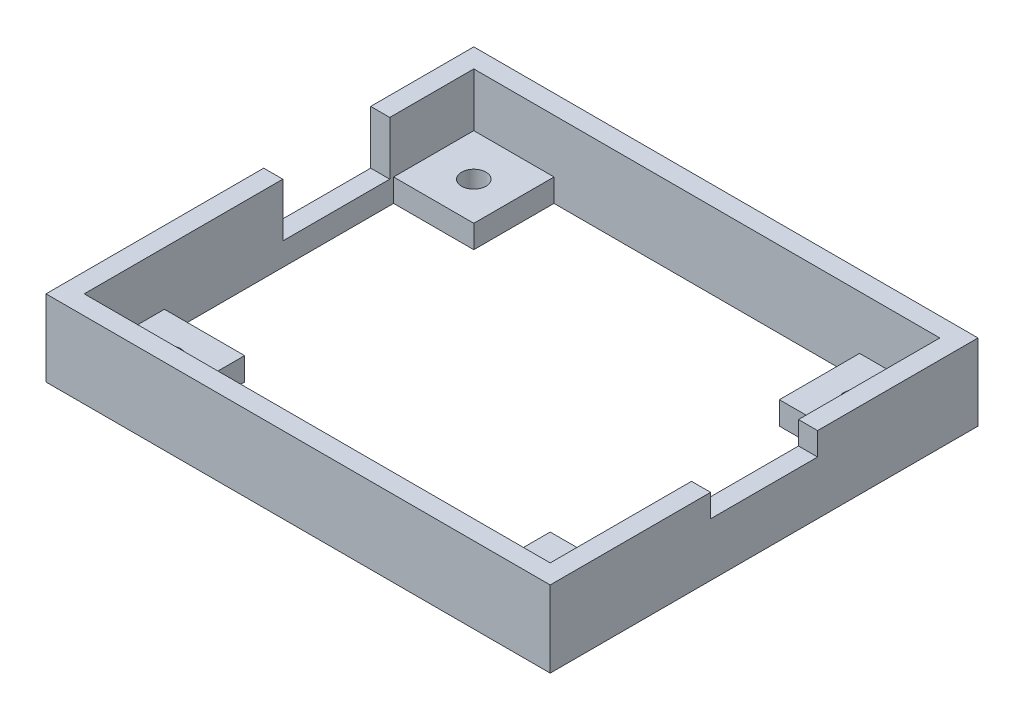
from build123d import *

# Parameters (mm, degrees)
SKETCH_1_W                  = 66
SKETCH_1_H                  = 56
EXTRUDE_1_DEPTH             = 10
SKETCH_2_W                  = 61
SKETCH_2_H                  = 51
CUT_EXTRUDE_1_DEPTH         = 7
SKETCH_3_R                  = 1.6
CUT_EXTRUDE_2_DEPTH         = 44.840620434
PATTERN_LINEAR_1_COUNT      = 2
PATTERN_LINEAR_1_PITCH      = 50
PATTERN_LINEAR_1_COUNT_DIR2 = 2
PATTERN_LINEAR_1_PITCH_DIR2 = 40
SKETCH_4_W                  = 40
SKETCH_4_H                  = 10.5
SKETCH_4_W_2                = 10.5
SKETCH_4_H_2                = 30
CUT_EXTRUDE_3_DEPTH         = 44.840620434
SKETCH_6_W                  = 14
SKETCH_6_H                  = 7
CUT_EXTRUDE_6_DEPTH         = 10
SKETCH_7_W                  = 14
SKETCH_7_H                  = 3
CUT_EXTRUDE_7_DEPTH         = 10


with BuildPart() as part:
    # 草图1 → 凸台-拉伸1 (new body)
    with BuildSketch(Plane(origin=(0, 0, 0), x_dir=(1, 0, 0), z_dir=(0, 1, 0))):
        Rectangle(SKETCH_1_W, SKETCH_1_H)
    extrude(amount=EXTRUDE_1_DEPTH)

    # 草图2 → 切除-拉伸1 (cut)
    with BuildSketch(Plane(origin=(0, 10, 0), x_dir=(1, 0, 0), z_dir=(0, 1, 0))):
        Rectangle(SKETCH_2_W, SKETCH_2_H)
    extrude(amount=-CUT_EXTRUDE_1_DEPTH, mode=Mode.SUBTRACT)

    # 草图3 → 切除-拉伸2 (cut, through all)
    with BuildSketch(Plane(origin=(0, 3, 0), x_dir=(1, 0, 0), z_dir=(0, 1, 0))):
        with Locations(Location((-25, 20, 0), (0, 0, 270))):
            Circle(SKETCH_3_R)
    cut_extrude_2 = extrude(amount=-CUT_EXTRUDE_2_DEPTH, mode=Mode.SUBTRACT)

    # 阵列(线性)1: Cut-Extrude 2 2 × 2
    with Locations(*[(i * PATTERN_LINEAR_1_PITCH, 0, j * PATTERN_LINEAR_1_PITCH_DIR2) for i in range(PATTERN_LINEAR_1_COUNT) for j in range(PATTERN_LINEAR_1_COUNT_DIR2) if (i, j) != (0, 0)]):
        add(cut_extrude_2, mode=Mode.SUBTRACT)

    # 草图4 → 切除-拉伸3 (cut, through all)
    with BuildSketch(Plane(origin=(0, 3, 0), x_dir=(1, 0, 0), z_dir=(0, 1, 0))):
        with Locations((0, 20.25)):
            Rectangle(SKETCH_4_W, SKETCH_4_H)
        with Locations((-25.25, 0)):
            Rectangle(SKETCH_4_W_2, SKETCH_4_H_2)
        Rectangle(SKETCH_4_W, SKETCH_4_H_2)
        with Locations((0, -20.25)):
            Rectangle(SKETCH_4_W, SKETCH_4_H)
        with Locations((25.25, 0)):
            Rectangle(SKETCH_4_W_2, SKETCH_4_H_2)
    extrude(amount=-CUT_EXTRUDE_3_DEPTH, mode=Mode.SUBTRACT)

    # 草图6 → 切除-拉伸6 (cut)
    with BuildSketch(Plane(origin=(-30.5, 0, 0), x_dir=(0, 0, -1), z_dir=(1, 0, 0))):
        with Locations((7.5, 6.5)):
            Rectangle(SKETCH_6_W, SKETCH_6_H)
    extrude(amount=-CUT_EXTRUDE_6_DEPTH, mode=Mode.SUBTRACT)

    # 草图7 → 切除-拉伸7 (cut)
    with BuildSketch(Plane(origin=(33, 0, 0), x_dir=(0, 0, -1), z_dir=(1, 0, 0))):
        with Locations((0, 8.5)):
            Rectangle(SKETCH_7_W, SKETCH_7_H)
    extrude(amount=-CUT_EXTRUDE_7_DEPTH, mode=Mode.SUBTRACT)


solid = part.part
